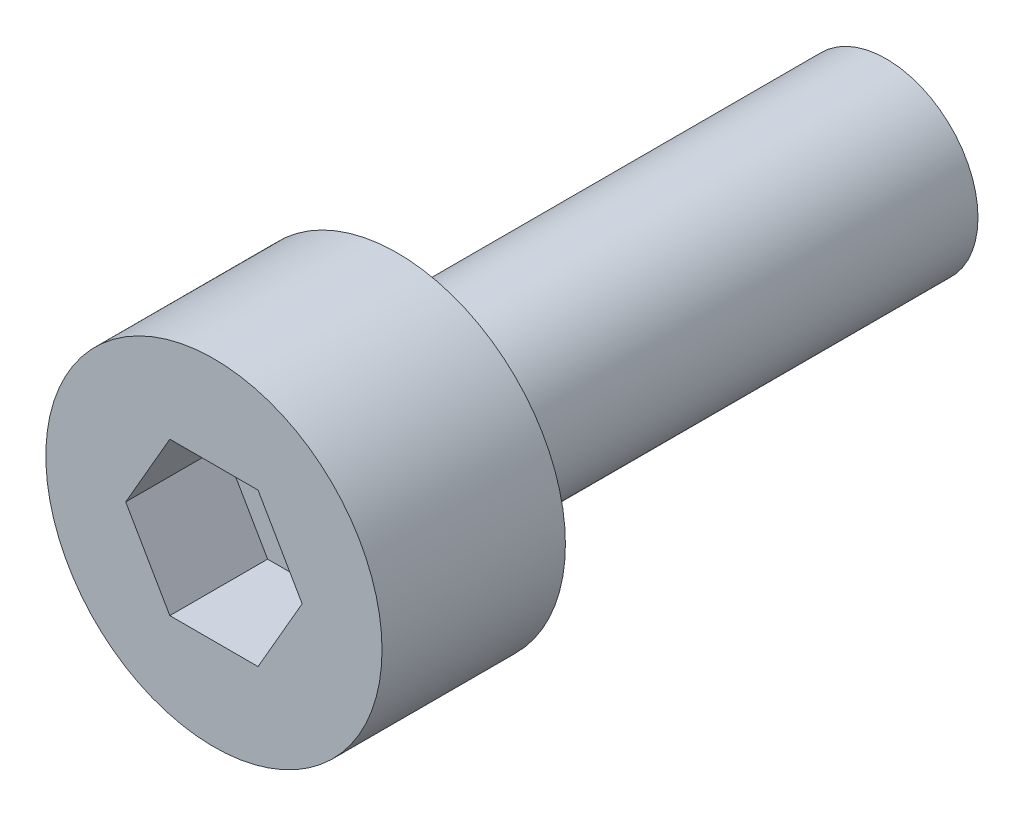
from build123d import *

# Parameters (mm, degrees)
SKETCH1_R    = 1.5
SHANK_DEPTH  = 8
SKETCH2_R    = 2.75
HEAD_DEPTH   = 3
SOCKET_DEPTH = 1.6


with BuildPart() as part:
    # Sketch1 → Shank (new body)
    with BuildSketch(Plane.XY):
        Circle(SKETCH1_R)
    extrude(amount=SHANK_DEPTH)

    # Sketch2 → Head (add)
    with BuildSketch(Plane.XY.offset(8)):
        Circle(SKETCH2_R)
    extrude(amount=HEAD_DEPTH)

    # Sketch3 → Socket (cut)
    with BuildSketch(Plane.XY.offset(9.4)):
        Polygon((1.443375673, 0), (0.721687836, 1.25), (-0.721687836, 1.25), (-1.443375673, 0), (-0.721687836, -1.25), (0.721687836, -1.25), align=None)
    extrude(amount=SOCKET_DEPTH, mode=Mode.SUBTRACT)


solid = part.part
